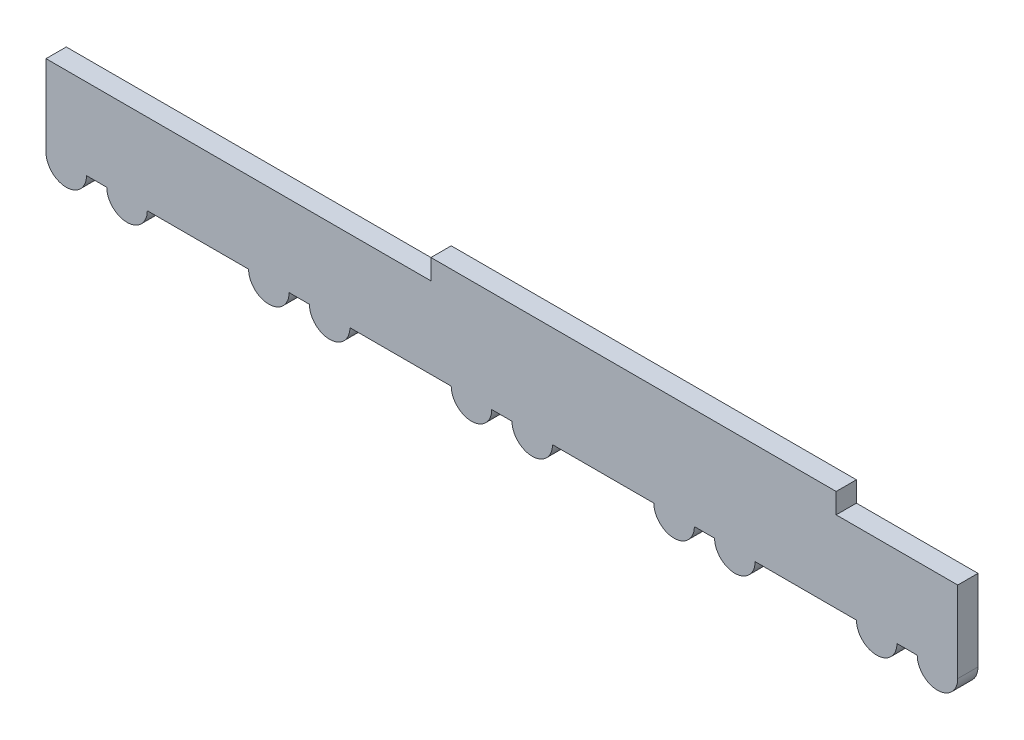
from build123d import *

# Parameters (mm, degrees)
SKIZZE1_W                       = 100
SKIZZE1_H                       = 5
AUFSATZ_LINEAR_AUSTRAGEN1_DEPTH = 5


with BuildPart() as part:
    # Skizze1 → Aufsatz-Linear austragen1 (new body)
    with BuildSketch(Plane.XY):
        with BuildLine():
            Line((97.5, -10), (102.5, -10))
            ThreePointArc((102.5, -10), (107.5, -15), (112.5, -10))
            Line((112.5, -10), (112.5, 10))
            Line((112.5, 10), (-112.5, 10))
            Line((-112.5, 10), (-112.5, -10))
            ThreePointArc((-112.5, -10), (-107.5, -15), (-102.5, -10))
            Line((-102.5, -10), (-97.5, -10))
            ThreePointArc((-97.5, -10), (-92.5, -15), (-87.5, -10))
            Line((-87.5, -10), (-52.5, -10))
            Line((-52.5, -10), (-47.5, -10))
            ThreePointArc((-47.5, -10), (-42.5, -15), (-37.5, -10))
            Line((-37.5, -10), (-12.5, -10))
            ThreePointArc((-12.5, -10), (-7.5, -15), (-2.5, -10))
            Line((-2.5, -10), (2.5, -10))
            ThreePointArc((2.5, -10), (7.5, -15), (12.5, -10))
            Line((12.5, -10), (37.5, -10))
            ThreePointArc((37.5, -10), (42.5, -15), (47.5, -10))
            Line((47.5, -10), (52.5, -10))
            ThreePointArc((52.5, -10), (57.5, -15), (62.5, -10))
            Line((62.5, -10), (87.5, -10))
            ThreePointArc((87.5, -10), (92.5, -15), (97.5, -10))
        make_face()
        with Locations((32.5, 12.5)):
            Rectangle(SKIZZE1_W, SKIZZE1_H)
        with BuildLine():
            Line((-52.5, -10), (-62.5, -10))
            ThreePointArc((-62.5, -10), (-57.5, -15), (-52.5, -10))
        make_face()
    extrude(amount=AUFSATZ_LINEAR_AUSTRAGEN1_DEPTH)


solid = part.part
